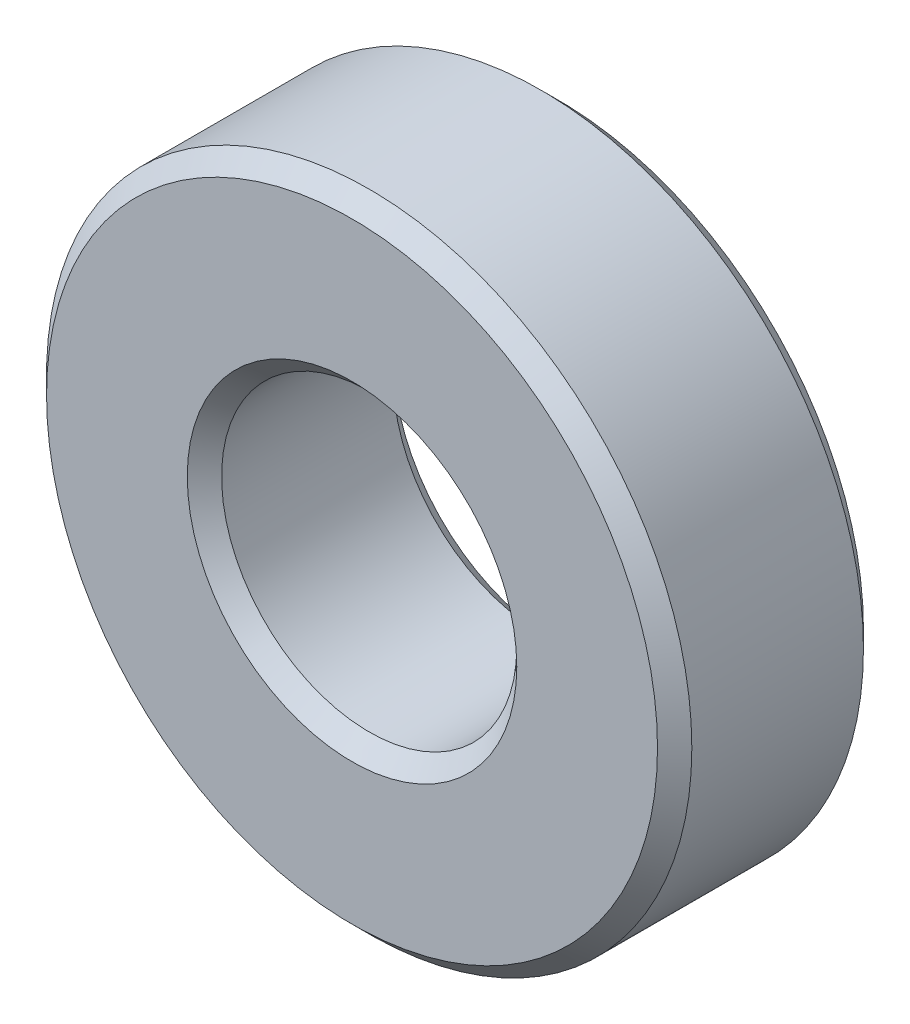
from build123d import *

# Parameters (mm, degrees)
SKETCH1_R           = 9.4
SKETCH1_R_2         = 4.3
BOSS_EXTRUDE1_DEPTH = 6
CHAMFER1_SIZE       = 0.5


with BuildPart() as part:
    # Sketch1 → Boss-Extrude1 (new body)
    with BuildSketch(Plane.XY):
        Circle(SKETCH1_R)
        Circle(SKETCH1_R_2, mode=Mode.SUBTRACT)
    extrude(amount=BOSS_EXTRUDE1_DEPTH)

    # Chamfer1
    chamfer1_edges = [part.edges().sort_by_distance(p)[0] for p in [
        (-9.4, 0, 0),
        (-9.4, 0, 6),
        (-4.3, 0, 0),
        (-4.3, 0, 6),
    ]]
    chamfer(chamfer1_edges, length=CHAMFER1_SIZE)


solid = part.part
